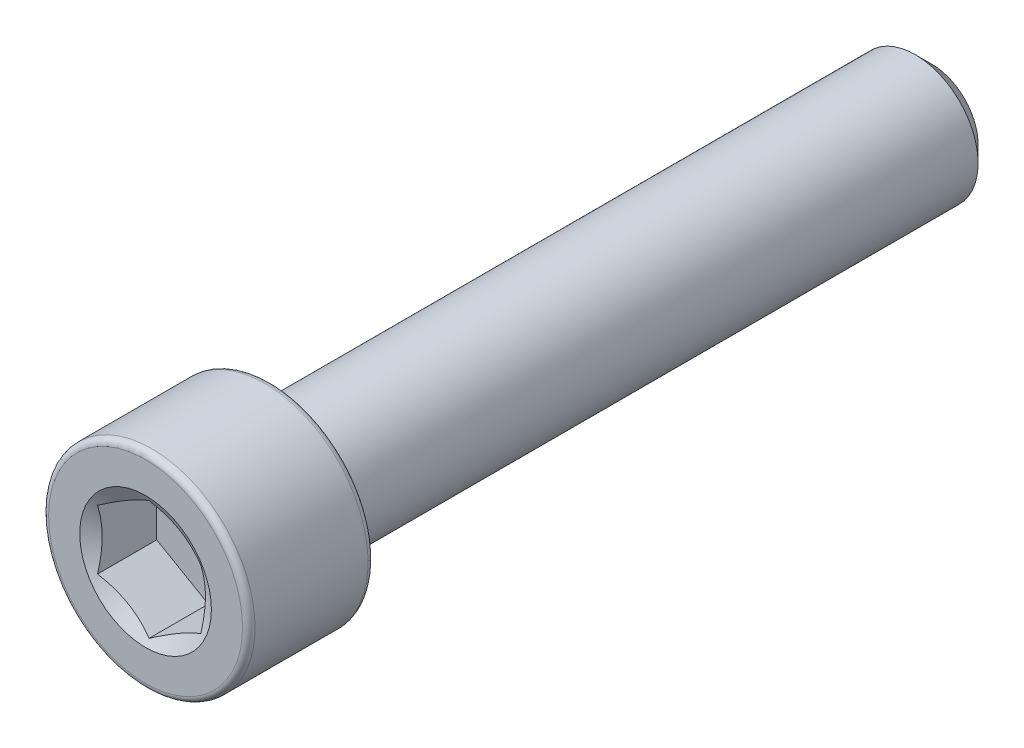
from build123d import *

# Parameters (mm, degrees)
CUT_EXTRUDE1_START = 15.113
CUT_EXTRUDE1_DEPTH = 2.413


with BuildPart() as part:
    # Sketch2 → Revolve1 (revolve)
    with BuildSketch(Plane(origin=(0, 0, 0), x_dir=(0, 0, -1), z_dir=(1, 0, 0)), mode=Mode.PRIVATE) as revolve1_sk:
        with BuildLine():
            Line((15.113, 0), (15.113, 1.778))
            Line((15.113, 1.778), (14.478, 2.413))
            Line((14.478, 2.413), (-10.287, 2.413))
            Line((-10.287, 2.413), (-10.287, 3.72745))
            ThreePointArc((-10.287, 3.72745), (-10.357675134, 3.898074866), (-10.5283, 3.96875))
            Line((-10.5283, 3.96875), (-14.8717, 3.96875))
            ThreePointArc((-14.8717, 3.96875), (-15.042324866, 3.898074866), (-15.113, 3.72745))
            Line((-15.113, 3.72745), (-15.113, 0))
            Line((-15.113, 0), (15.113, 0))
        make_face()
    revolve(revolve1_sk.sketch.rotate(Axis((0, 0, -15.113), (0, 0, 1)), 90), axis=Axis((0, 0, -15.113), (0, 0, 1)))

    # Sketch3 → Cut-Extrude1 (cut)
    with BuildSketch(Plane.XY.offset(CUT_EXTRUDE1_START)):
        Polygon((-1.984375, 1.14567944), (-1.984375, -1.14567944), (0, -2.291358881), (1.984375, -1.14567944), (1.984375, 1.14567944), (0, 2.291358881), align=None)
    extrude(amount=-CUT_EXTRUDE1_DEPTH, mode=Mode.SUBTRACT)

    # Cut-Extrude2 cone 1 section (through the dimple's axis) → Cut-Extrude2 (revolve, cut)
    with BuildSketch(Plane(origin=(0, 0, 15.113), x_dir=(0, -1, 0), z_dir=(1, 0, 0))):
        Polygon((0, 0), (2.530707401, 0), (0, 1.461104599), align=None)
    revolve(axis=Axis((0, 0, 15.113), (0, 0, -1)), mode=Mode.SUBTRACT)


solid = part.part
